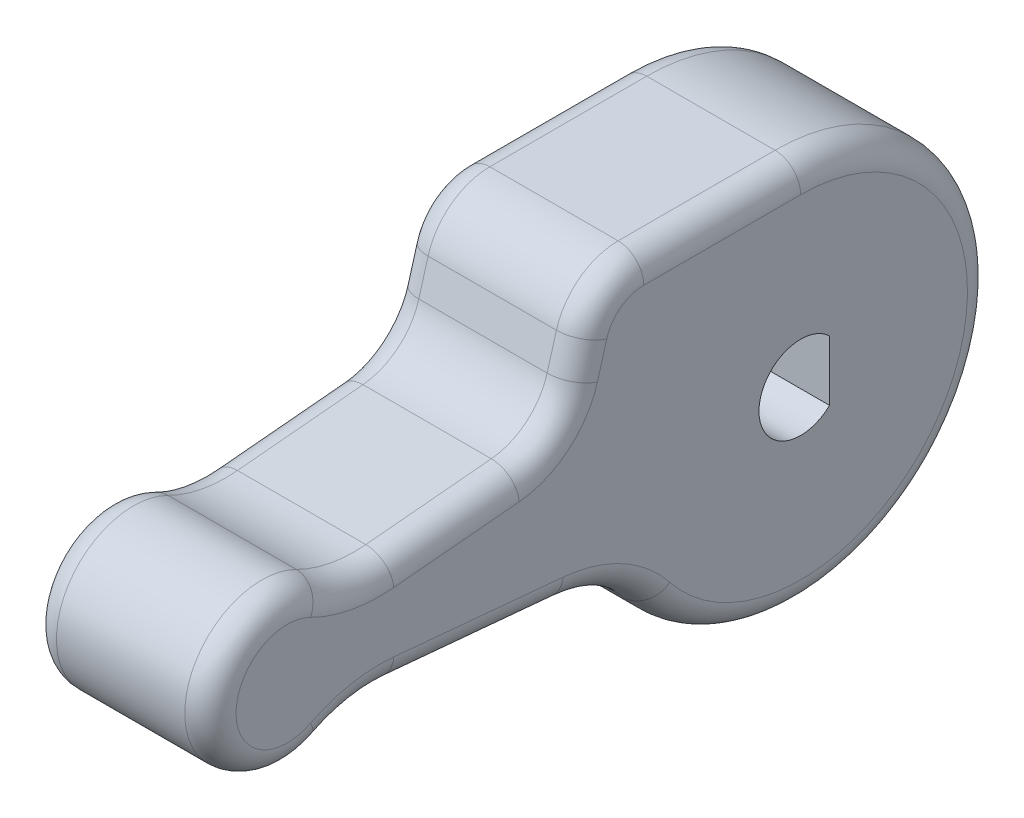
from build123d import *

# Parameters (mm, degrees)
BOSS_EXTRUDE1_DEPTH = 3.5
FILLET1_R           = 5
HOLE1_D             = 2.5
HOLE1_DEPTH         = 8
HOLE1_CBORE_D       = 3.5
HOLE1_CBORE_DEPTH   = 3
BOSS_EXTRUDE2_DEPTH = 7
FILLET3_R           = 2.5
FILLET2_R           = 1


with BuildPart() as part:
    # Sketch1 → Boss-Extrude1 (new, symmetric)
    with BuildSketch(Plane(origin=(0, 0, 0), x_dir=(0, 0, -1), z_dir=(1, 0, 0))):
        with BuildLine():
            Line((-17.763932023, 2), (-6.873863542, 3))
            ThreePointArc((-6.873863542, 3), (7.5, 0), (-6.873863542, -3))
            Line((-6.873863542, -3), (-17.763932023, -2))
            ThreePointArc((-17.763932023, -2), (-23, 0), (-17.763932023, 2))
        make_face()
        with BuildLine():
            Line((1.125, -1.17260394), (1.125, 1.17260394))
            ThreePointArc((1.125, 1.17260394), (-1.625, 0), (1.125, -1.17260394))
        make_face(mode=Mode.SUBTRACT)
    extrude(amount=BOSS_EXTRUDE1_DEPTH, both=True)

    # Fillet1
    fillet1_edges = [part.edges().sort_by_distance(p)[0] for p in [
        (0, 2, 17.763932023),
        (0, 3, 6.873863542),
        (0, -3, 6.873863542),
        (0, -2, 17.763932023),
    ]]
    fillet(fillet1_edges, radius=FILLET1_R)

    # Hole1
    with Locations(Plane(origin=(0, 0, -7.625), x_dir=(1, 0, 0), z_dir=(0, 0, -1))):
        with Locations((0, 0)):
            CounterBoreHole(HOLE1_D / 2, HOLE1_CBORE_D / 2, HOLE1_CBORE_DEPTH, depth=HOLE1_DEPTH)

    # Sketch4 → Boss-Extrude2 (add, through all)
    with BuildSketch(Plane(origin=(3.5, 0, 0), x_dir=(0, 0, -1), z_dir=(1, 0, 0))):
        with BuildLine():
            Line((0, 7.5), (-8, 7.5))
            Line((-8, 7.5), (-9.348908132, 2.772724607))
            ThreePointArc((-9.348908132, 2.772724607), (-7.423390623, 3.356027744), (-5.883671087, 4.651065957))
            ThreePointArc((-5.883671087, 4.651065957), (-3.268562782, 6.750296093), (0, 7.5))
        make_face()
    extrude(amount=-BOSS_EXTRUDE2_DEPTH)

    # Fillet3
    fillet3_edges = [part.edges().sort_by_distance(p)[0] for p in [
        (0, 2.772724607, 9.348908132),
        (0, 7.5, 8),
    ]]
    fillet(fillet3_edges, radius=FILLET3_R)

    # Fillet2
    fillet2_edges = [part.edges().sort_by_distance(p)[0] for p in [
        (-3.5, 0, 23),
        (3.5, 0, 23),
        (-3.5, -3.268562782, -6.750296093),
        (3.5, -3.268562782, -6.750296093),
        (-3.5, -2.469818808, 12.647573032),
        (3.5, -2.469818808, 12.647573032),
        (-3.5, 2.233464618, 17.334759204),
        (3.5, 2.233464618, 17.334759204),
        (-3.5, -3.356027744, 7.423390623),
        (3.5, -3.356027744, 7.423390623),
        (-3.5, -2.233464618, 17.334759204),
        (3.5, -2.233464618, 17.334759204),
        (-3.5, 7.5, 3.056789081),
        (3.5, 7.5, 3.056789081),
        (-3.5, 2.391513819, 13.50031972),
        (3.5, 2.391513819, 13.50031972),
        (3.5, 5.052820312, 8.698292421),
        (-3.5, 5.052820312, 8.698292421),
        (3.5, 6.995615118, 7.619406937),
        (-3.5, 6.995615118, 7.619406937),
        (-3.5, 3.181037085, 9.687418633),
        (3.5, 3.181037085, 9.687418633),
    ]]
    fillet(fillet2_edges, radius=FILLET2_R)


solid = part.part
